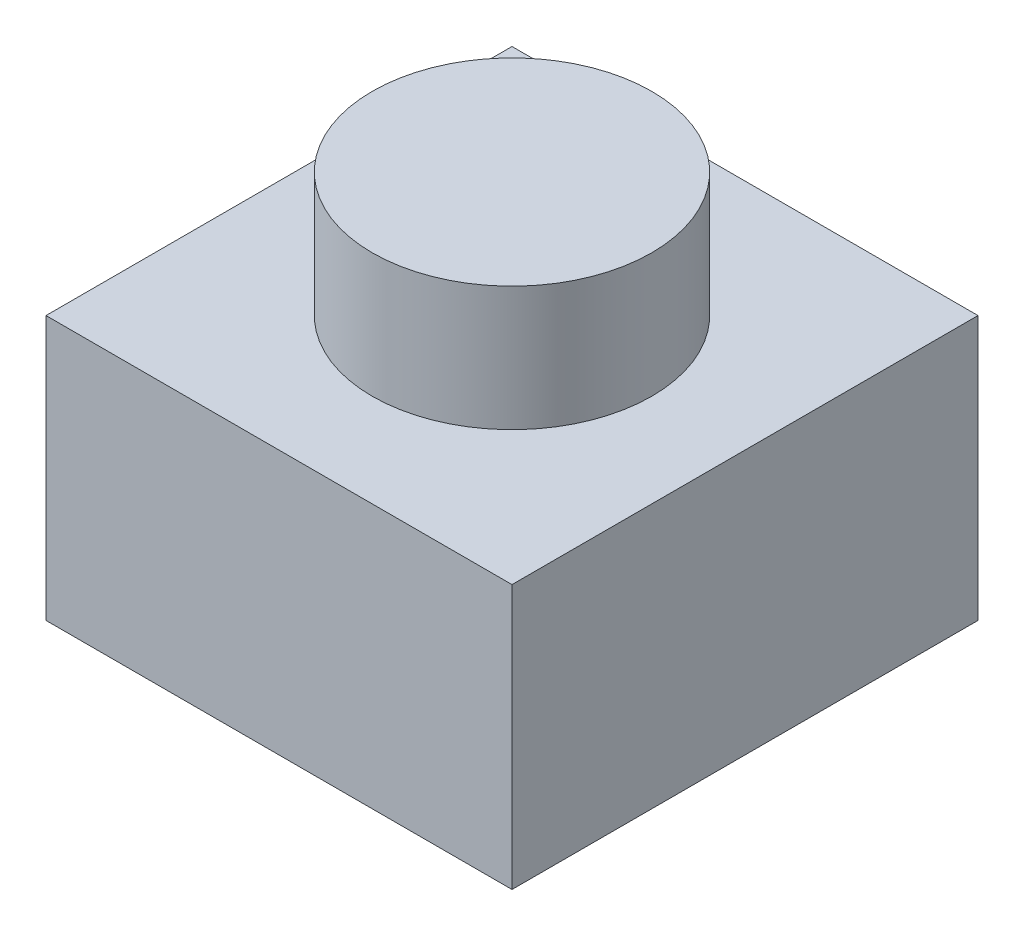
from build123d import *

# Parameters (mm, degrees)
SKETCH1_W           = 6
SKETCH1_H           = 6
BOSS_EXTRUDE1_DEPTH = 3.4
SKETCH2_R           = 1.8
BOSS_EXTRUDE2_DEPTH = 1.6


with BuildPart() as part:
    # Sketch1 → Boss-Extrude1 (new body)
    with BuildSketch(Plane(origin=(0, 0, 0), x_dir=(1, 0, 0), z_dir=(0, 1, 0))):
        with Locations((3, 3)):
            Rectangle(SKETCH1_W, SKETCH1_H)
    extrude(amount=BOSS_EXTRUDE1_DEPTH)

    # Sketch2 → Boss-Extrude2 (add)
    with BuildSketch(Plane(origin=(0, 3.4, 0), x_dir=(1, 0, 0), z_dir=(0, 1, 0))):
        with Locations(Location((3, 3, 0), (0, 0, 270))):
            Circle(SKETCH2_R)
    extrude(amount=BOSS_EXTRUDE2_DEPTH)


solid = part.part
